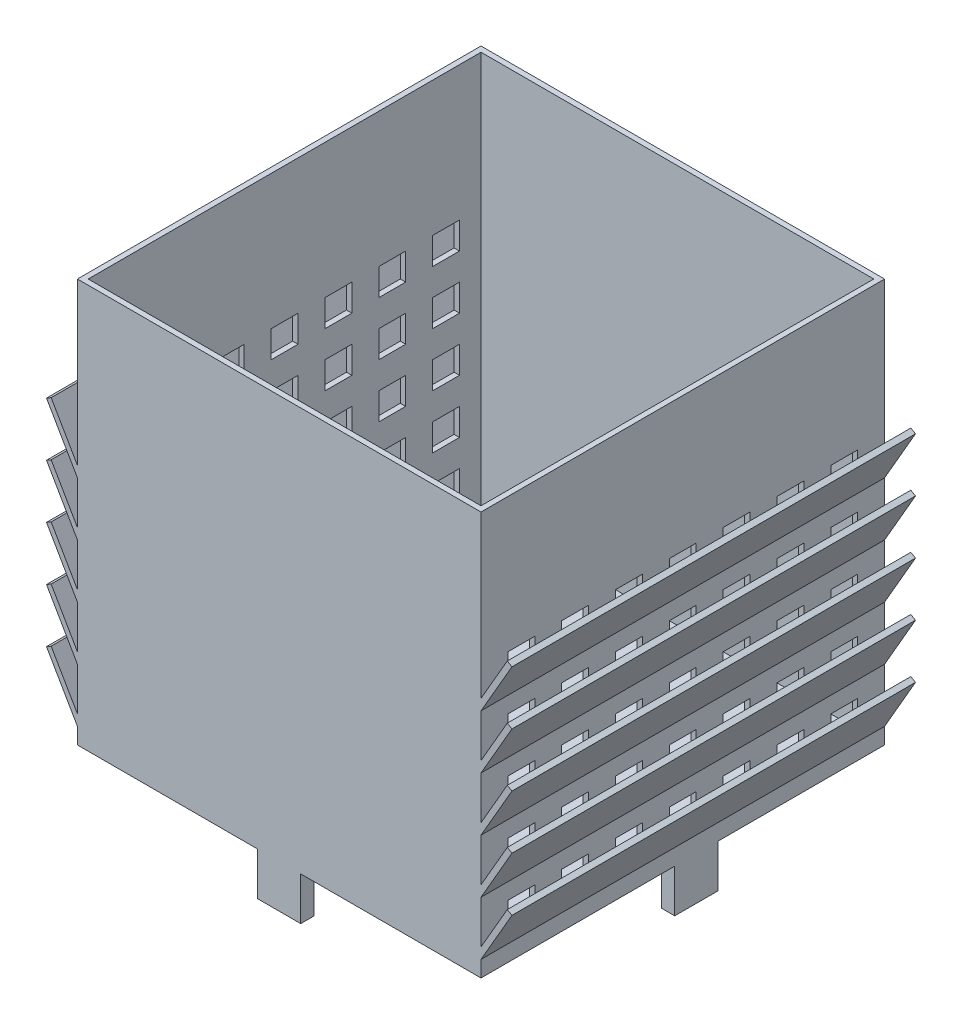
from build123d import *

# Parameters (mm, degrees)
SKETCH_1_W                  = 150
SKETCH_1_H                  = 150
EXTRUDE_1_DEPTH             = 150
SHELL_1_T                   = -2
SKETCH_2_W                  = 10
SKETCH_2_H                  = 10
CUT_EXTRUDE_1_DEPTH         = 474
PATTERN_LINEAR_1_COUNT      = 5
PATTERN_LINEAR_1_PITCH      = 20
PATTERN_LINEAR_1_COUNT_DIR2 = 7
PATTERN_LINEAR_1_PITCH_DIR2 = 20
EXTRUDE_2_DEPTH             = 150
PATTERN_LINEAR_2_COUNT      = 5
PATTERN_LINEAR_2_PITCH      = 20
EXTRUDE_3_DEPTH             = 150
PATTERN_LINEAR_3_COUNT      = 5
PATTERN_LINEAR_3_PITCH      = 20
SKETCH_5_W                  = 5
SKETCH_5_H                  = 16
SKETCH_5_W_2                = 16
SKETCH_5_H_2                = 5
EXTRUDE_4_DEPTH             = 16


with BuildPart() as part:
    # 草图1 → 凸台-拉伸1 (new body)
    with BuildSketch(Plane(origin=(0, 0, 0), x_dir=(1, 0, 0), z_dir=(0, 1, 0))):
        with Locations((75, 75)):
            Rectangle(SKETCH_1_W, SKETCH_1_H)
    extrude(amount=EXTRUDE_1_DEPTH)

    # 抽壳1
    shell_1_openings = [part.faces().sort_by_distance(p)[0] for p in [
        (75, 150, -75),
    ]]
    offset(amount=SHELL_1_T, openings=shell_1_openings, kind=Kind.INTERSECTION)

    # 草图2 → 切除-拉伸1 (cut)
    with BuildSketch(Plane.ZY):
        with Locations((-135, 15)):
            Rectangle(SKETCH_2_W, SKETCH_2_H)
    cut_extrude_1 = extrude(amount=-CUT_EXTRUDE_1_DEPTH, mode=Mode.SUBTRACT)

    # 阵列(线性)1: Cut-Extrude 1 5 × 7
    with Locations(*[(0, i * PATTERN_LINEAR_1_PITCH, j * PATTERN_LINEAR_1_PITCH_DIR2) for i in range(PATTERN_LINEAR_1_COUNT) for j in range(PATTERN_LINEAR_1_COUNT_DIR2) if (i, j) != (0, 0)]):
        add(cut_extrude_1, mode=Mode.SUBTRACT)

    # 草图3 → 凸台-拉伸2 (add)
    with BuildSketch(Plane.XY):
        Polygon((0, 10), (-9.767949192, 26.918584287), (-11.5, 25.918584287), (0, 6), align=None)
    extrude_2 = extrude(amount=-EXTRUDE_2_DEPTH)

    # 阵列(线性)2: 凸台-拉伸2 ×5
    with Locations(*[(0, i * PATTERN_LINEAR_2_PITCH, 0) for i in range(1, PATTERN_LINEAR_2_COUNT)]):
        add(extrude_2)

    # 草图4 → 凸台-拉伸3 (add)
    with BuildSketch(Plane(origin=(0, 0, -150), x_dir=(-1, 0, 0), z_dir=(0, 0, -1))):
        Polygon((-150, 10), (-159.767949192, 26.918584287), (-161.5, 25.918584287), (-150, 6), align=None)
    extrude_3 = extrude(amount=-EXTRUDE_3_DEPTH)

    # 阵列(线性)3: 凸台-拉伸3 ×5
    with Locations(*[(0, i * PATTERN_LINEAR_3_PITCH, 0) for i in range(1, PATTERN_LINEAR_3_COUNT)]):
        add(extrude_3)

    # 草图5 → 凸台-拉伸4 (add)
    with BuildSketch(Plane(origin=(0, 0, 0), x_dir=(-1, 0, 0), z_dir=(0, -1, 0))):
        with Locations((-2.5, 80)):
            Rectangle(SKETCH_5_W, SKETCH_5_H)
        with Locations((-147.5, 80)):
            Rectangle(SKETCH_5_W, SKETCH_5_H)
        with Locations((-75, 2.5)):
            Rectangle(SKETCH_5_W_2, SKETCH_5_H_2)
        with Locations((-75, 147.5)):
            Rectangle(SKETCH_5_W_2, SKETCH_5_H_2)
    extrude(amount=EXTRUDE_4_DEPTH)


solid = part.part
